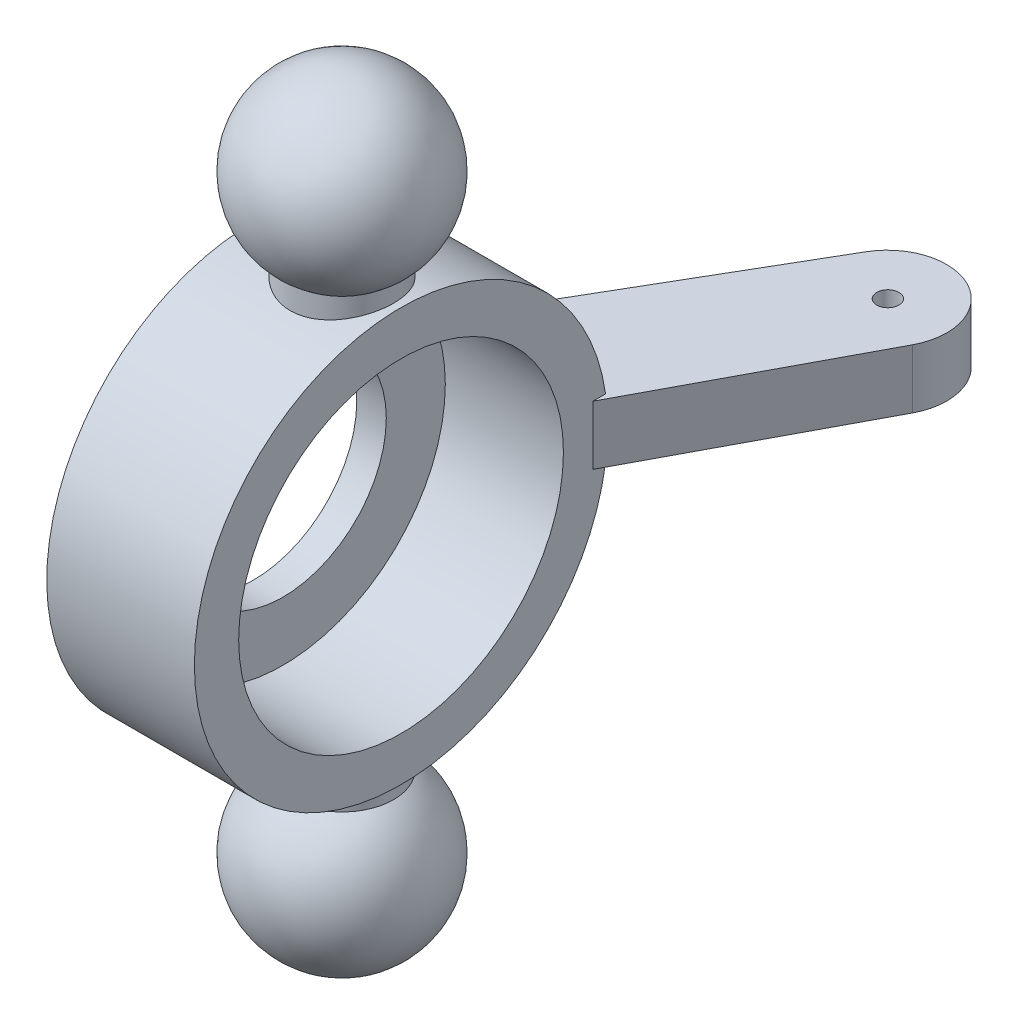
from build123d import *

# Parameters (mm, degrees)
SKETCH1_R                = 14
SKETCH1_R_2              = 11
BOSS_EXTRUDE1_DEPTH      = 8
SKETCH2_W                = 3.5
SKETCH2_H                = 8
SKETCH4_R                = 14
SKETCH4_R_2              = 7
BOSS_EXTRUDE2_DEPTH      = 2
BOSS_EXTRUDE3_DEPTH      = 2
BOSS_EXTRUDE3_DEPTH_BACK = 2
SKETCH5_R                = 0.75


with BuildPart() as part:
    # Sketch1 → Boss-Extrude1 (new body)
    with BuildSketch(Plane(origin=(0, 0, 0), x_dir=(0, 0, -1), z_dir=(1, 0, 0))):
        Circle(SKETCH1_R)
        Circle(SKETCH1_R_2, mode=Mode.SUBTRACT)
    extrude(amount=BOSS_EXTRUDE1_DEPTH)

    # Sketch2 → Revolve1 (revolve)
    with BuildSketch(Plane(origin=(4, 0, 0), x_dir=(0, 0, -1), z_dir=(1, 0, 0))):
        with Locations((1.75, 16)):
            Rectangle(SKETCH2_W, SKETCH2_H)
    revolve1 = revolve(axis=Axis((4, 12, 0), (0, 1, 0)))

    # Sketch3 → Revolve2 (revolve)
    with BuildSketch(Plane(origin=(4, 0, 0), x_dir=(0, 0, -1), z_dir=(1, 0, 0))):
        with BuildLine():
            Line((0, 26), (0, 14))
            ThreePointArc((0, 14), (6, 20), (0, 26))
        make_face()
    revolve2 = revolve(axis=Axis((4, 14, 0), (0, 1, 0)))

    # Mirror1: Revolve1, Revolve2 across plane
    add(revolve1.mirror(Plane.ZX))
    add(revolve2.mirror(Plane.ZX))

    # Sketch4 → Boss-Extrude2 (add)
    with BuildSketch(Plane(origin=(8, 0, 0), x_dir=(0, 0, -1), z_dir=(1, 0, 0))):
        Circle(SKETCH4_R)
        Circle(SKETCH4_R_2, mode=Mode.SUBTRACT)
    extrude(amount=BOSS_EXTRUDE2_DEPTH)

    # Sketch5 → Boss-Extrude3 (add, two sides: drawn at the far end of the back side and taken through both)
    with BuildSketch(Plane(origin=(0, 0, 0), x_dir=(1, 0, 0), z_dir=(0, 1, 0)).offset(-BOSS_EXTRUDE3_DEPTH_BACK)):
        with BuildLine():
            Line((10, 13), (0, 13))
            Line((0, 13), (-7.508861075, 27.122113749))
            ThreePointArc((-7.508861075, 27.122113749), (-7.405739907, 31.0601523), (-3.977070704, 33))
            Line((-3.977070704, 33), (-3.934896023, 33))
            ThreePointArc((-3.934896023, 33), (-1.940550712, 32.467360203), (-0.477339242, 31.01129339))
            Line((-0.477339242, 31.01129339), (10, 13))
        make_face()
        with Locations((-3.977070704, 29)):
            Circle(SKETCH5_R, mode=Mode.SUBTRACT)
    extrude(amount=BOSS_EXTRUDE3_DEPTH + BOSS_EXTRUDE3_DEPTH_BACK)


with BuildPart() as body_2:
    # Mirror2: mirrored copy
    add(part.part.mirror(Plane(origin=(10, 0, 0), x_dir=(0, 0, 1), z_dir=(1, 0, 0))))


solid = body_2.part
